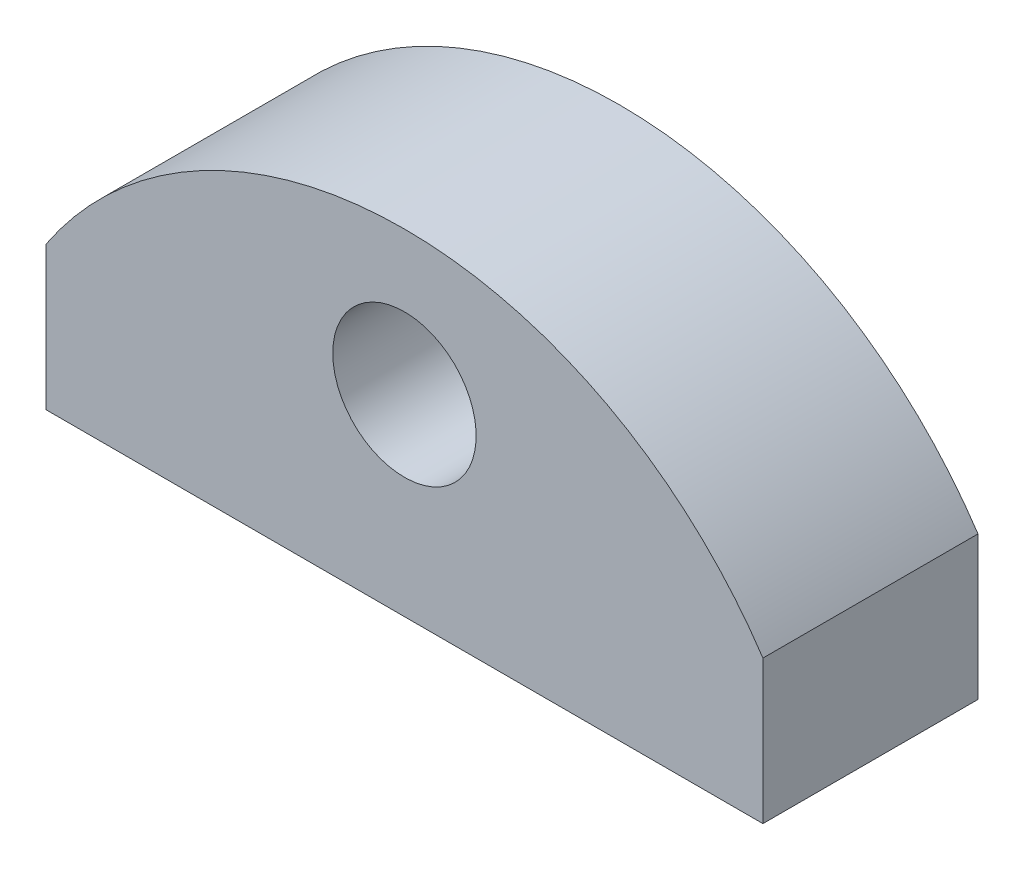
from build123d import *

# Parameters (mm, degrees)
BOSS_EXTRUDE1_DEPTH = 15
CUT_EXTRUDE1_REACH  = 34.094
SKETCH2_R           = 5


with BuildPart() as part:
    # Sketch1 → Boss-Extrude1 (new body)
    with BuildSketch(Plane.XY):
        with BuildLine():
            Line((-25, 0), (-25, -10))
            Line((-25, -10), (25, -10))
            Line((25, -10), (25, 0))
            ThreePointArc((25, 0), (0, 13.416876048), (-25, 0))
        make_face()
    extrude(amount=BOSS_EXTRUDE1_DEPTH)

    # Sketch2 → Cut-Extrude1 (cut, up to next)
    with BuildSketch(Plane(origin=(0, 0, 0), x_dir=(-1, 0, 0), z_dir=(0, 0, -1)), mode=Mode.PRIVATE) as cut_extrude1_sk1:
        with Locations((0, 3.416876048)):
            Circle(SKETCH2_R)
    cut_extrude1_tool1 = extrude(cut_extrude1_sk1.sketch, amount=-CUT_EXTRUDE1_REACH, mode=Mode.PRIVATE) & part.part
    add(cut_extrude1_tool1.solids().sort_by_distance((0, 3.416876, 0))[0], mode=Mode.SUBTRACT)


solid = part.part
